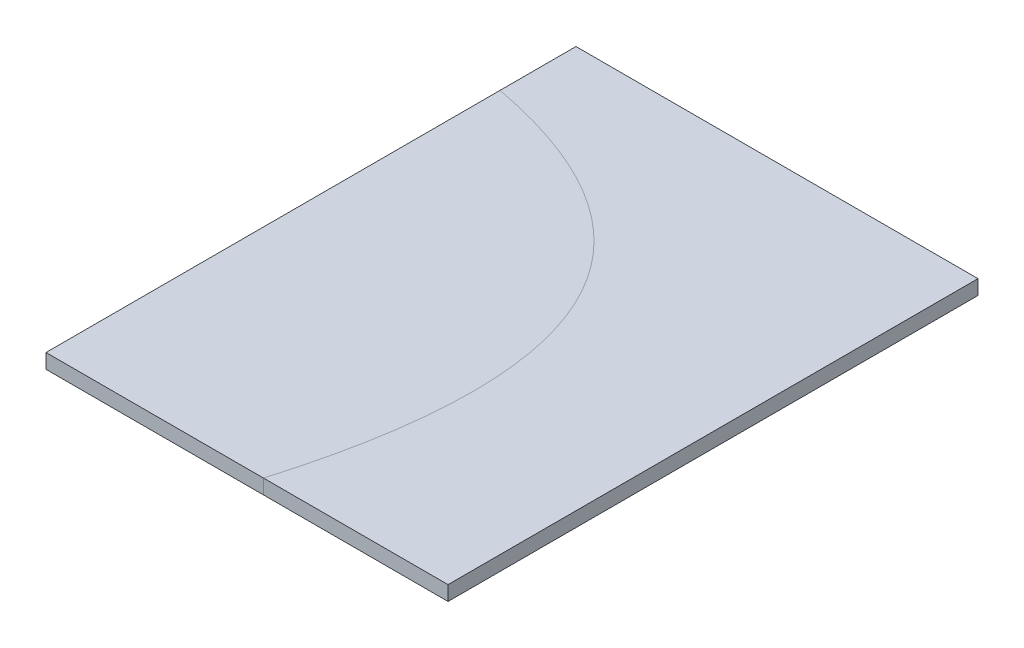
from build123d import *

# Parameters (mm, degrees)
SKETCH1_W           = 1100
SKETCH1_H           = 1450
BOSS_EXTRUDE1_DEPTH = 40
SKETCH2_R           = 70
SKETCH2_R_2         = 50
BOSS_EXTRUDE2_DEPTH = 40
CUT_EXTRUDE1_DEPTH  = 1020
BOSS_EXTRUDE3_DEPTH = 40


with BuildPart() as part:
    # Sketch1 → Boss-Extrude1 (new body)
    with BuildSketch(Plane(origin=(0, 0, 0), x_dir=(1, 0, 0), z_dir=(0, 1, 0))):
        with Locations((-67.777777778, 238.333333333)):
            Rectangle(SKETCH1_W, SKETCH1_H)
    extrude(amount=BOSS_EXTRUDE1_DEPTH)

    # Sketch2 → Boss-Extrude2 (add)
    with BuildSketch(Plane.XZ):
        with Locations(Location((217.222222222, 221.666666667, 0), (0, 0, 90))):
            Circle(SKETCH2_R)
        with Locations(Location((217.222222222, 221.666666667, 0), (0, 0, 270))):
            Circle(SKETCH2_R_2, mode=Mode.SUBTRACT)
    extrude(amount=BOSS_EXTRUDE2_DEPTH)

    # Sketch6 → Cut-Extrude1 (cut)
    with BuildSketch(Plane.XZ):
        with BuildLine():
            Line((-617.777777778, -238.333333333), (-617.777777778, -755.586382029))
            add(Edge.make_bspline(
                [(-22.62076559, 486.666666667), (293.432590218, -583.780996804), (-617.777777778, -755.586382029)],
                knots=[0, 0, 0, 1, 1, 1], degree=2))
            Line((-22.62076559, 486.666666667), (-617.777777778, 486.666666667))
            Line((-617.777777778, 486.666666667), (-617.777777778, -238.333333333))
        make_face()
    extrude(amount=-CUT_EXTRUDE1_DEPTH, mode=Mode.SUBTRACT)


with BuildPart() as body_2:
    # Sketch8 → Boss-Extrude3 (new body)
    with BuildSketch(Plane.XZ):
        with BuildLine():
            Line((-22.62076559, 486.666666666), (-617.777777778, 486.666666667))
            Line((-617.777777778, 486.666666667), (-617.777777777, -755.586382029))
            add(Edge.make_bspline(
                [(-617.777777777, -755.586382029), (293.432590218, -583.780996804), (-22.62076559, 486.666666666)],
                knots=[0, 0, 0, 1, 1, 1], degree=2))
        make_face()
    extrude(amount=-BOSS_EXTRUDE3_DEPTH)


solid = Compound([part.part, body_2.part])
